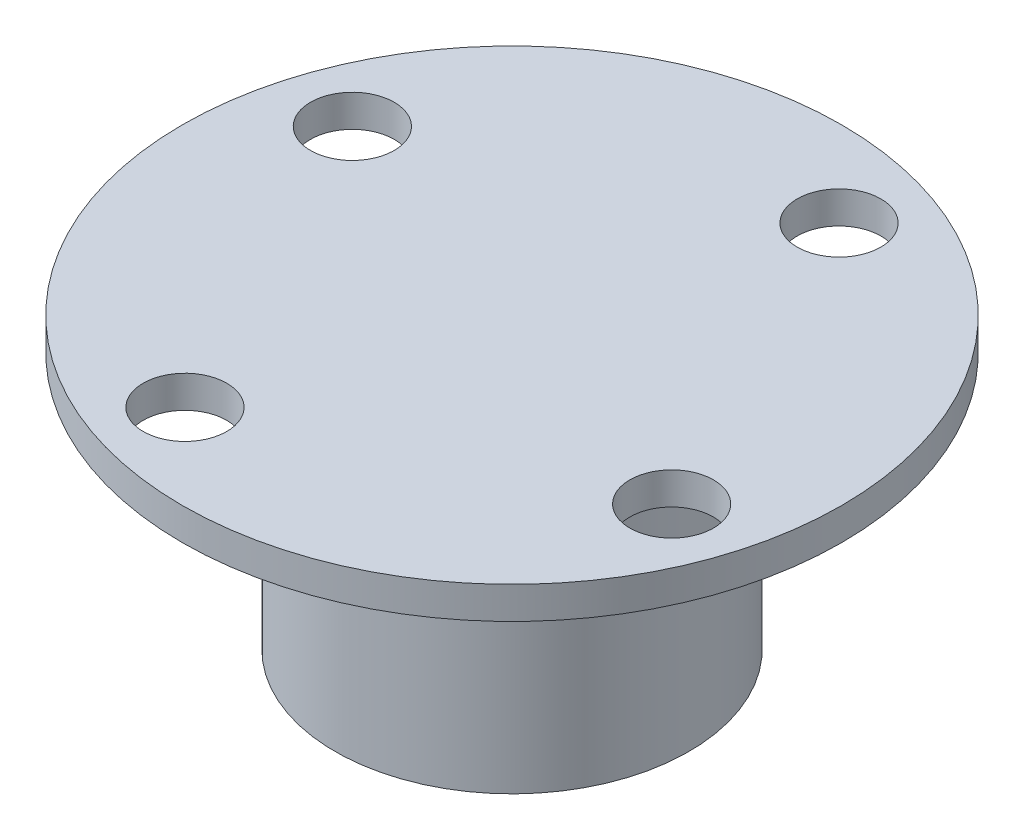
from build123d import *

# Parameters (mm, degrees)
ESQUISSE1_R                  = 10.25
BOSS_EXTRU_1_DEPTH           = 1
D_GAGEMENT_M21_D             = 2.6
R_P_TITION_CIRCULAIRE1_COUNT = 4
ESQUISSE9_R                  = 5.5
BOSS_EXTRU_4_DEPTH           = 8
ENL_V_MAT_EXTRU_1_DEPTH      = 6
CONG_1_R                     = 0.5


with BuildPart() as part:
    # Esquisse1 → Boss.-Extru.1 (new body)
    with BuildSketch(Plane.XZ.offset(38.601290575)):
        with Locations(Location((14.017249305, 17.25, 0), (0, 0, 270))):
            Circle(ESQUISSE1_R)
    extrude(amount=BOSS_EXTRU_1_DEPTH)

    # Dégagement M21 (through all)
    with Locations(Plane(origin=(0, -39.601290575, 0), x_dir=(-1, 0, 0), z_dir=(0, -1, 0))):
        with Locations((-11.415520349, -24.815117741)):
            d_gagement_m21 = Hole(D_GAGEMENT_M21_D / 2)

    # Répétition circulaire1: Dégagement M21 ×4 about axis
    r_p_tition_circulaire1_axis = Axis((14.017249305, 0, 17.25), (0, 1, 0))
    for i in range(1, R_P_TITION_CIRCULAIRE1_COUNT):
        add(d_gagement_m21.rotate(r_p_tition_circulaire1_axis, i * 360 / R_P_TITION_CIRCULAIRE1_COUNT), mode=Mode.SUBTRACT)

    # Esquisse9 → Boss.-Extru.4 (add)
    with BuildSketch(Plane(origin=(0, -39.601290575, 0), x_dir=(-1, 0, 0), z_dir=(0, -1, 0))):
        with Locations(Location((-14.017249305, -17.25, 0), (0, 0, 90))):
            Circle(ESQUISSE9_R)
    extrude(amount=BOSS_EXTRU_4_DEPTH)

    # Esquisse10 → Enlèv. mat.-Extru.1 (cut)
    with BuildSketch(Plane.XZ.offset(47.601290575)):
        with BuildLine():
            Line((11.904786288, 19.85), (16.129712323, 19.85))
            ThreePointArc((16.129712323, 19.85), (14.017249305, 13.9), (11.904786288, 19.85))
        make_face()
    extrude(amount=-ENL_V_MAT_EXTRU_1_DEPTH, mode=Mode.SUBTRACT)

    # Congé1
    cong_1_edges = [part.edges().sort_by_distance(p)[0] for p in [
        (14.017249305, -39.601290575, 22.75),
    ]]
    fillet(cong_1_edges, radius=CONG_1_R)


solid = part.part
